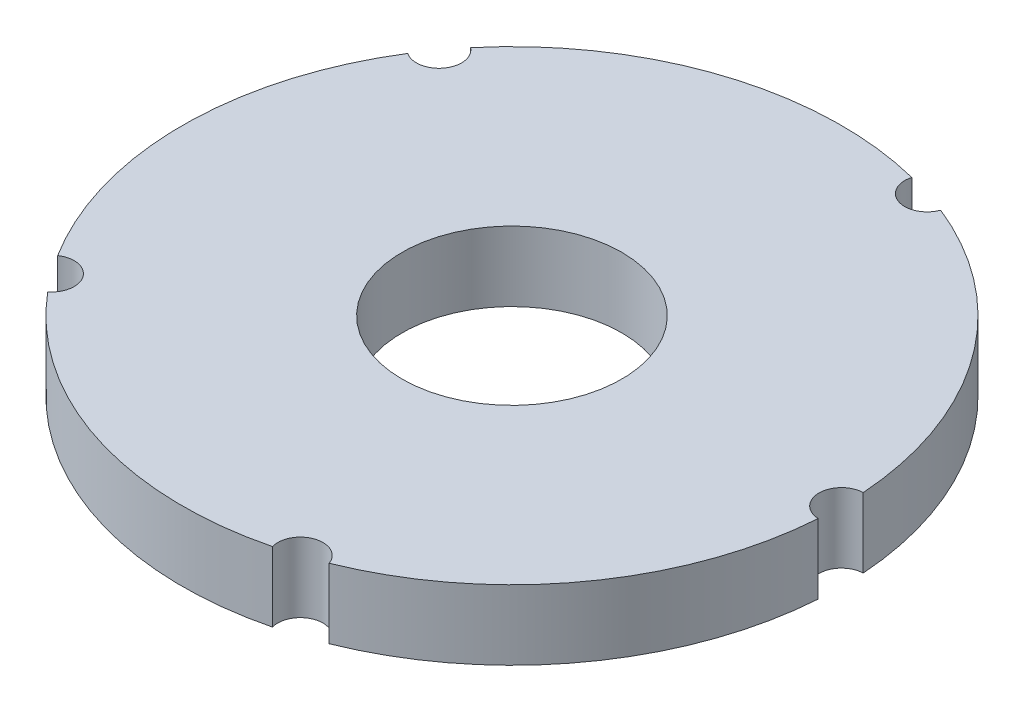
from build123d import *

# Parameters (mm, degrees)
SKETCH1_R           = 10
BOSS_EXTRUDE1_DEPTH = 6.35


with BuildPart() as part:
    # Sketch1 → Boss-Extrude1 (new body)
    with BuildSketch(Plane(origin=(0, 0, 0), x_dir=(1, 0, 0), z_dir=(0, 1, 0))):
        with BuildLine():
            ThreePointArc((29.929958333, 2.048803105), (24.270509831, 17.633557569), (11.19739331, 27.831966928))
            ThreePointArc((11.19739331, 27.831966928), (8.637024993, 26.58202963), (7.300338222, 29.098196883))
            ThreePointArc((7.300338222, 29.098196883), (-9.270509831, 28.531695489), (-23.009588682, 19.249904641))
            ThreePointArc((-23.009588682, 19.249904641), (-22.612024993, 16.428597802), (-25.418101183, 15.93487158))
            ThreePointArc((-25.418101183, 15.93487158), (-30, 0), (-25.418101183, -15.93487158))
            ThreePointArc((-25.418101183, -15.93487158), (-22.612024993, -16.428597802), (-23.009588682, -19.249904641))
            ThreePointArc((-23.009588682, -19.249904641), (-9.270509831, -28.531695489), (7.300338222, -29.098196883))
            ThreePointArc((7.300338222, -29.098196883), (8.637024993, -26.58202963), (11.19739331, -27.831966928))
            ThreePointArc((11.19739331, -27.831966928), (24.270509831, -17.633557569), (29.929958333, -2.048803105))
            ThreePointArc((29.929958333, -2.048803105), (27.95, 0), (29.929958333, 2.048803105))
        make_face()
        with Locations(Location((0, 0, 0), (0, 0, 270))):
            Circle(SKETCH1_R, mode=Mode.SUBTRACT)
    extrude(amount=BOSS_EXTRUDE1_DEPTH)


solid = part.part
